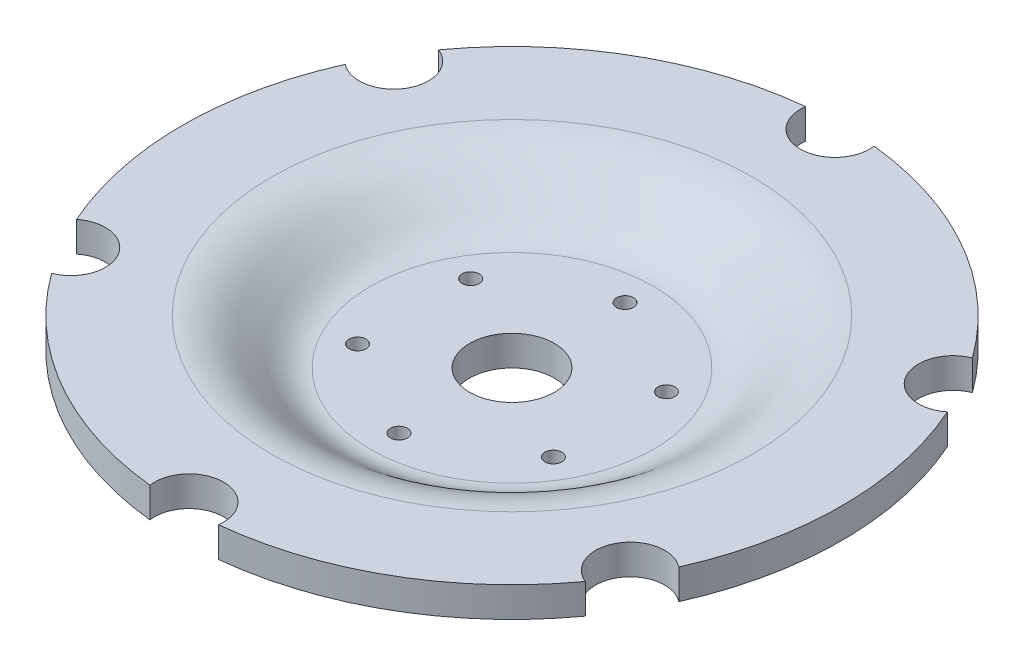
from build123d import *

# Parameters (mm, degrees)
F_23_0_23_DIAMETER_HOLE2_D = 23
M5_CLEARANCE_HOLE1_D       = 5.64
M25_CLEARANCE_HOLE1_D      = 28.2


with BuildPart() as part:
    # Sketch1 → Revolve1 (revolve)
    with BuildSketch(Plane(origin=(0, 0, 0), x_dir=(-1, 0, 0), z_dir=(0, 0, -1)), mode=Mode.PRIVATE) as revolve1_sk:
        with BuildLine():
            Line((0, -21.28), (-47, -21.28))
            add(Edge.make_bspline(
                [(-47, -21.28), (-48.103397798, -21.28), (-50.355208609, -21.119817001), (-53.414331373, -20.453461244), (-56.243773206, -19.439198841), (-59.638625381, -17.760520516), (-63.24918477, -15.301778213), (-66.920694033, -12.332831089), (-70.220914899, -9.726996026), (-72.788397394, -8.094435047), (-74.823949114, -7.162885506), (-76.366758302, -6.651929985), (-77.75784267, -6.37664197), (-78.927463, -6.261355146), (-79.581421905, -6.24), (-79.9, -6.24)],
                knots=[0, 0, 0, 0, 0.0625, 0.125, 0.1875, 0.25, 0.375, 0.5, 0.625, 0.75, 0.8125, 0.875, 0.9375, 0.96875, 1, 1, 1, 1], degree=3))
            Line((-79.9, -6.24), (-109.626011544, -6.24))
            Line((-109.626011544, -6.24), (-109.626011544, 3.76))
            Line((-109.626011544, 3.76), (-79.9, 3.76))
            add(Edge.make_bspline(
                [(-47, -11.28), (-47.323760623, -11.28), (-47.9824274, -11.256801184), (-49.205881481, -11.125337538), (-50.652473039, -10.813460463), (-52.303634488, -10.223599604), (-54.465904258, -9.163050099), (-57.16913982, -7.350711887), (-60.559773273, -4.61985368), (-64.271682561, -1.670850737), (-67.847161888, 0.63981733), (-71.12599799, 2.151104958), (-73.810430606, 3.042514571), (-76.243250574, 3.525131309), (-78.291888688, 3.725497683), (-79.368008784, 3.76), (-79.9, 3.76)],
                knots=[0, 0, 0, 0, 0.03125, 0.0625, 0.125, 0.1875, 0.25, 0.375, 0.5, 0.625, 0.75, 0.8125, 0.875, 0.9375, 0.96875, 1, 1, 1, 1], degree=3))
            Line((-47, -11.28), (0, -11.28))
            Line((0, -11.28), (0, -21.28))
        make_face()
    revolve(revolve1_sk.sketch.rotate(Axis((0, -15.043324423, 0), (0, 1, 0)), 270), axis=Axis((0, -15.043324423, 0), (0, 1, 0)))

    # Ø23.0 (23) Diameter Hole2 (through all)
    with Locations(Plane(origin=(0, 3.76, 0), x_dir=(1, 0, 0), z_dir=(0, 1, 0))):
        with Locations((-92.997954647, 53.69239415), (92.997954647, -53.69239415), (92.997954647, 53.69239415), (0, 107.3847883), (-92.997954647, -53.69239415), (0, -107.3847883)):
            Hole(F_23_0_23_DIAMETER_HOLE2_D / 2)

    # M5 Clearance Hole1 (through all)
    with Locations(Plane(origin=(0, -11.28, 0), x_dir=(1, 0, 0), z_dir=(0, 1, 0))):
        with Locations((-32.562555182, 18.8), (0, 37.6), (32.562555182, 18.8), (32.562555182, -18.8), (0, -37.6), (-32.562555182, -18.8)):
            Hole(M5_CLEARANCE_HOLE1_D / 2)

    # M25 Clearance Hole1 (through all)
    with Locations(Plane(origin=(0, -11.28, 0), x_dir=(1, 0, 0), z_dir=(0, 1, 0))):
        with Locations((0, 0)):
            Hole(M25_CLEARANCE_HOLE1_D / 2)


solid = part.part
